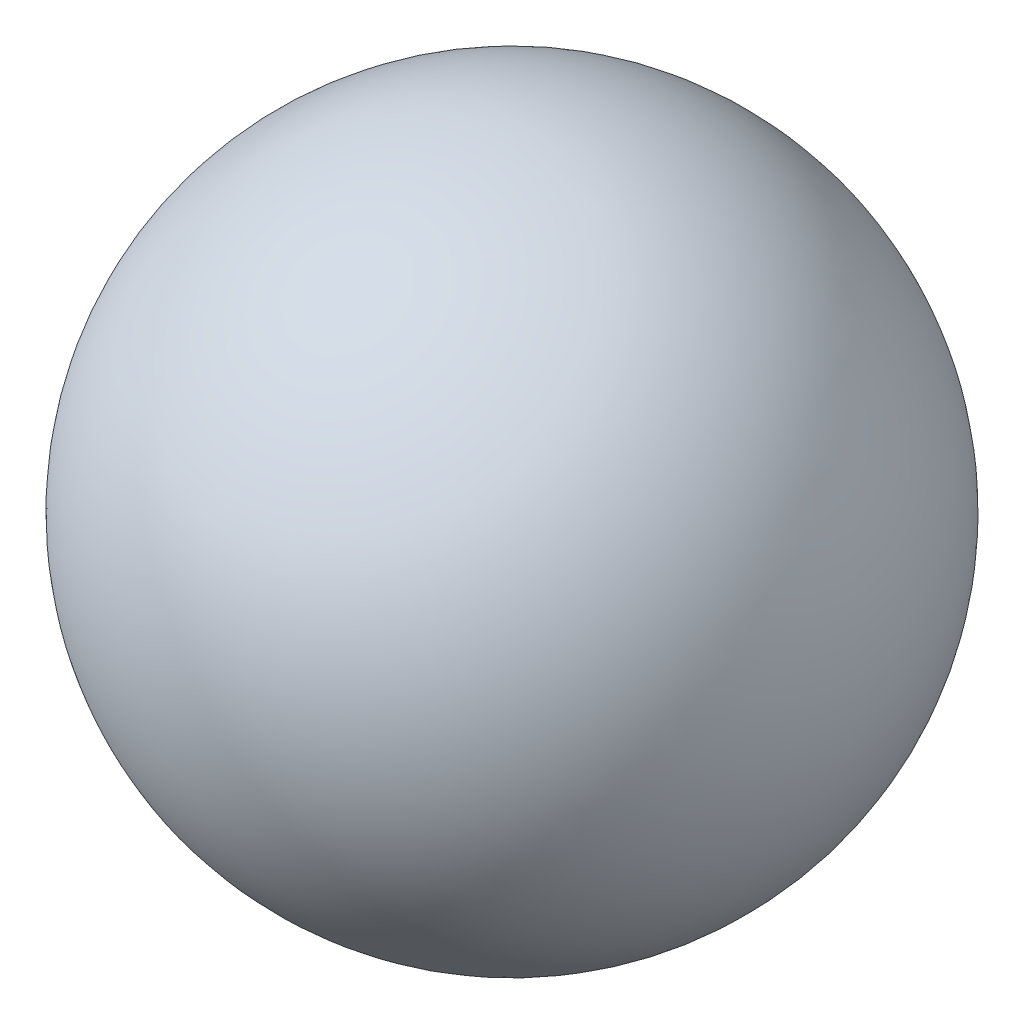
from build123d import *


with BuildPart() as part:
    # Sketch1 → Revolve1 (revolve)
    with BuildSketch(Plane(origin=(0, 0, 0), x_dir=(1, 0, 0), z_dir=(0, 1, 0))):
        with BuildLine():
            Line((0, 34.25), (0, -34.25))
            ThreePointArc((0, -34.25), (34.25, 0), (0, 34.25))
        make_face()
    revolve(axis=Axis((0, 0, -34.25), (0, 0, 1)))


solid = part.part
